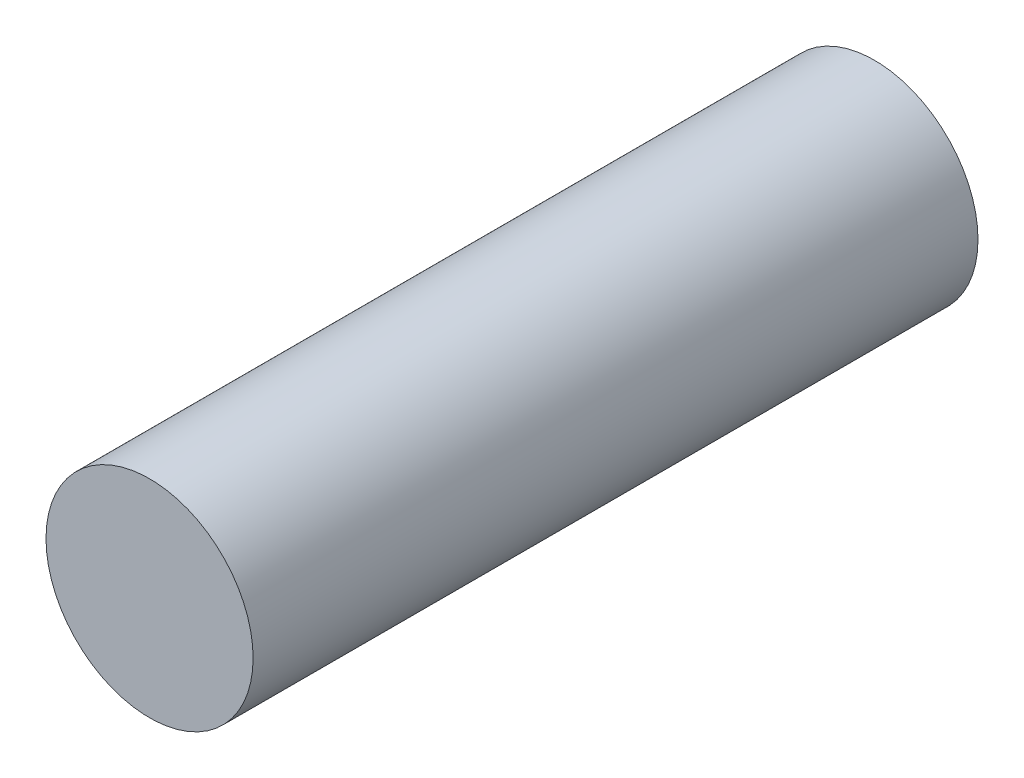
from build123d import *

# Parameters (mm, degrees)
SKETCH1_R      = 5
EXTRUDE1_DEPTH = 35


with BuildPart() as part:
    # Sketch1 → Extrude1 (new body)
    with BuildSketch(Plane.XY):
        Circle(SKETCH1_R)
    extrude(amount=-EXTRUDE1_DEPTH)


solid = part.part
